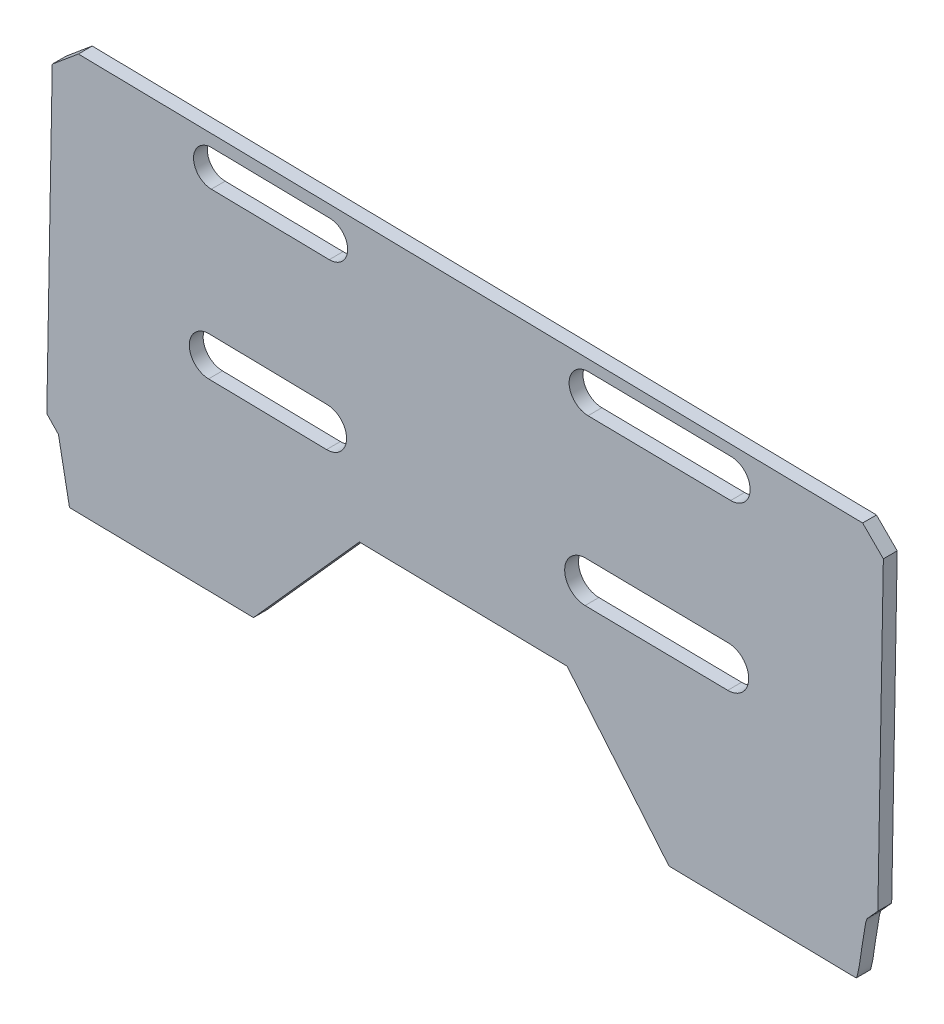
from build123d import *

# Parameters (mm, degrees)
BOSS_EXTRUDE1_DEPTH = 5
SCALE3_SCALE        = 0.7


with BuildPart() as part:
    # Sketch1 → Boss-Extrude1 (new body)
    with BuildSketch(Plane.XY):
        with BuildLine():
            Line((-21.110056664, -28.526587311), (-16.898456664, -32.954187311))
            Line((-16.898456664, -32.954187311), (-12.920956664, -53.805187311))
            Line((-12.920956664, -53.805187311), (53.488243336, -54.992087311))
            Line((53.488243336, -54.992087311), (91.698643336, -12.255587311))
            Line((91.698643336, -12.255587311), (166.686643336, -13.595687311))
            Line((166.686643336, -13.595687311), (203.464243336, -57.672187311))
            Line((203.464243336, -57.672187311), (271.018043336, -58.879487311))
            add(Edge.make_bspline(
                [(271.018043336, -58.879487311), (272.282443336, -57.480787311), (273.781143336, -39.658587311), (275.045543336, -38.259787311)],
                knots=[0.926829268, 0.926829268, 0.926829268, 0.926829268, 0.951219512, 0.951219512, 0.951219512, 0.951219512], degree=3))
            add(Edge.make_bspline(
                [(275.045543336, -38.259787311), (276.309943336, -36.860987311), (277.574343336, -35.462087311), (278.838843336, -34.063287311)],
                knots=[0.951219512, 0.951219512, 0.951219512, 0.951219512, 1, 1, 1, 1], degree=3))
            Line((278.838843336, -34.063287311), (280.824443336, 77.044112689))
            Line((280.824443336, 77.044112689), (273.344943336, 84.514112689))
            Line((273.344943336, 84.514112689), (-9.711656664, 89.572712689))
            Line((-9.711656664, 89.572712689), (-19.140256664, 81.699012689))
            Line((-19.140256664, 81.699012689), (-21.110056664, -28.526587311))
        make_face()
        with BuildLine():
            Line((38.492696137, 84.358812317), (81.065696137, 83.607512317))
            ThreePointArc((81.065696137, 83.607512317), (87.472612317, 76.970403863), (80.835503863, 70.563487683))
            Line((80.835503863, 70.563487683), (38.262503863, 71.314787683))
            ThreePointArc((38.262503863, 71.314787683), (31.855587683, 77.951896137), (38.492696137, 84.358812317))
        make_face(mode=Mode.SUBTRACT)
        with BuildLine():
            Line((174.424487767, 82.306994865), (225.921702724, 81.558393709))
            ThreePointArc((225.921702724, 81.558393709), (232.734401766, 74.544704176), (225.720712233, 67.732005135))
            Line((225.720712233, 67.732005135), (174.223497276, 68.480606291))
            ThreePointArc((174.223497276, 68.480606291), (167.410798234, 75.494295824), (174.424487767, 82.306994865))
        make_face(mode=Mode.SUBTRACT)
        with BuildLine():
            Line((173.373026329, 23.534372678), (224.8688668, 22.785434101))
            ThreePointArc((224.8688668, 22.785434101), (232.220423625, 15.216884147), (224.651873671, 7.865327322))
            Line((224.651873671, 7.865327322), (173.1560332, 8.614265899))
            ThreePointArc((173.1560332, 8.614265899), (165.804476375, 16.182815853), (173.373026329, 23.534372678))
        make_face(mode=Mode.SUBTRACT)
        with BuildLine():
            Line((79.855541718, 10.720254274), (37.283415598, 11.526634897))
            ThreePointArc((37.283415598, 11.526634897), (30.326934897, 18.751736266), (37.552036266, 25.708216968))
            Line((37.552036266, 25.708216968), (80.124162387, 24.901836345))
            ThreePointArc((80.124162387, 24.901836345), (87.080643088, 17.676734975), (79.855541718, 10.720254274))
        make_face(mode=Mode.SUBTRACT)
    extrude(amount=BOSS_EXTRUDE1_DEPTH)


with BuildPart() as part_1:
    # Scale3: scaled about (0, 0, 0)
    add(part.part.scale(SCALE3_SCALE))


solid = part_1.part
